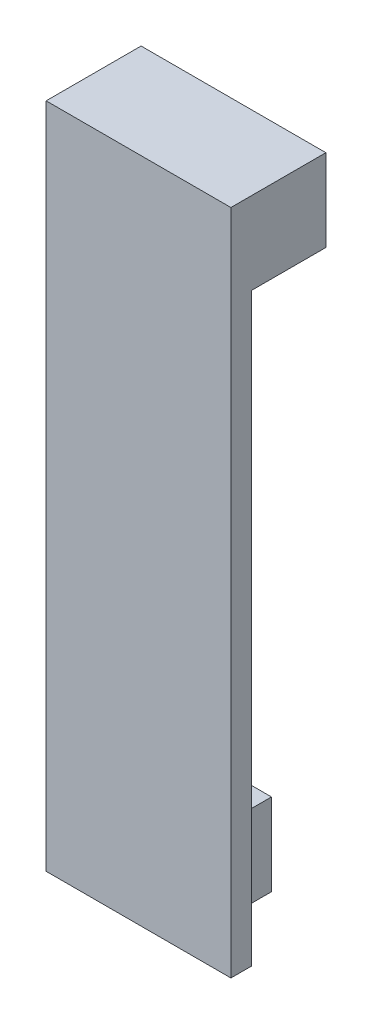
from build123d import *

# Parameters (mm, degrees)
BASIC_SHAPE_SKETCH_W     = 18
BASIC_SHAPE_SKETCH_H     = 65
BASIC_SHAPE_DEPTH        = 2
CONNECTOR_SKETCH_W       = 7.4
CONNECTOR_SKETCH_H       = 8
CONNECTOR_DEPTH          = 7.25
CONNECTOR_HOLES_SKETCH_W = 3
CONNECTOR_HOLES_SKETCH_H = 4.5
CONNECTOR_HOLES_DEPTH    = 5
SKETCH1_W                = 18
SKETCH1_H                = 8
BOSS_EXTRUDE1_DEPTH      = 7.25


with BuildPart() as part:
    # Basic Shape Sketch → Basic Shape (new body)
    with BuildSketch(Plane.XY):
        Rectangle(BASIC_SHAPE_SKETCH_W, BASIC_SHAPE_SKETCH_H)
    extrude(amount=BASIC_SHAPE_DEPTH)

    # Connector Sketch → Connector (add)
    with BuildSketch(Plane(origin=(0, 0, 0), x_dir=(-1, 0, 0), z_dir=(0, 0, -1))):
        with Locations((0, -28.5)):
            Rectangle(CONNECTOR_SKETCH_W, CONNECTOR_SKETCH_H)
    extrude(amount=CONNECTOR_DEPTH)

    # Connector Holes Sketch → Connector Holes (cut)
    with BuildSketch(Plane.XZ.offset(32.5)):
        with Locations((-1.7, -3.5)):
            Rectangle(CONNECTOR_HOLES_SKETCH_W, CONNECTOR_HOLES_SKETCH_H)
        with Locations((1.7, -3.5)):
            Rectangle(CONNECTOR_HOLES_SKETCH_W, CONNECTOR_HOLES_SKETCH_H)
    extrude(amount=-CONNECTOR_HOLES_DEPTH, mode=Mode.SUBTRACT)

    # Sketch1 → Boss-Extrude1 (add)
    with BuildSketch(Plane(origin=(0, 0, 0), x_dir=(-1, 0, 0), z_dir=(0, 0, -1))):
        with Locations((0, 28.5)):
            Rectangle(SKETCH1_W, SKETCH1_H)
    extrude(amount=BOSS_EXTRUDE1_DEPTH)


solid = part.part
